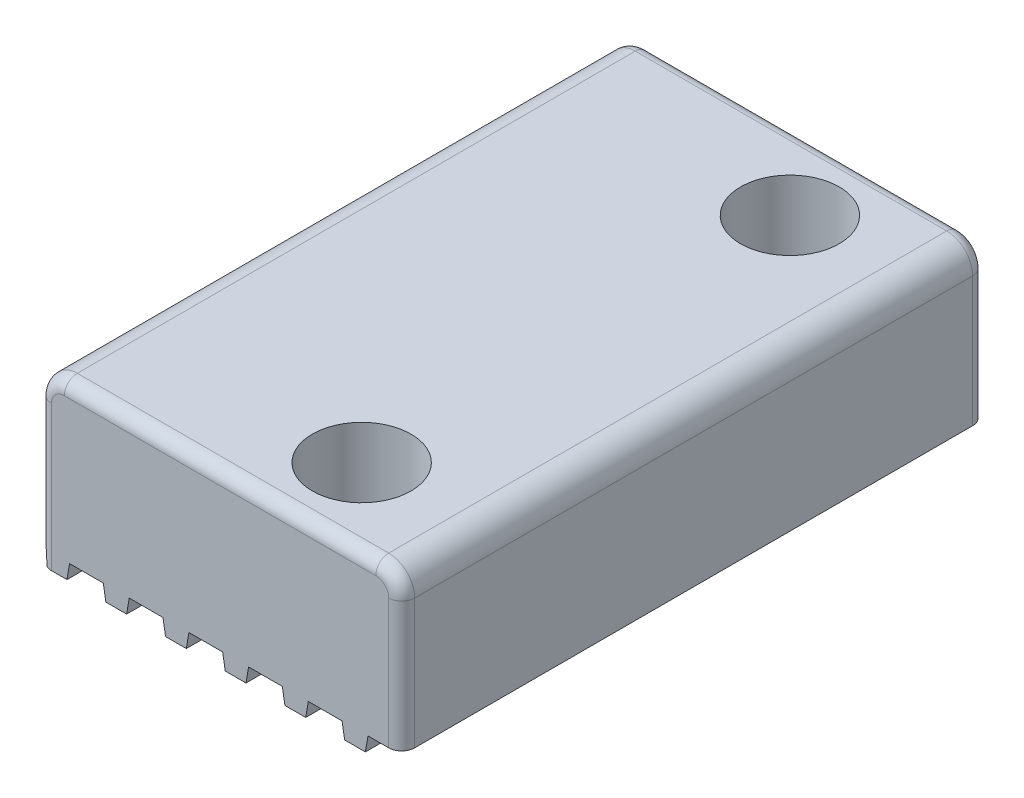
from build123d import *

# Parameters (mm, degrees)
BOSS_EXTRUDE1_DEPTH = 22.5
SKETCH2_R           = 1.9
CUT_EXTRUDE1_DEPTH  = 184.450850043
FILLET1_R           = 0.5


with BuildPart() as part:
    # Sketch1 → Boss-Extrude1 (new body)
    with BuildSketch(Plane.XY):
        with BuildLine():
            Line((167.946665474, 62.144706948), (167.946665474, 67.144706948))
            ThreePointArc((167.946665474, 67.144706948), (168.239558693, 67.851813729), (168.946665474, 68.144706948))
            Line((168.946665474, 68.144706948), (180.946665474, 68.144706948))
            ThreePointArc((180.946665474, 68.144706948), (181.653772255, 67.851813729), (181.946665474, 67.144706948))
            Line((181.946665474, 67.144706948), (181.946665474, 62.144706948))
            Line((181.946665474, 62.144706948), (180.646665474, 62.144706948))
            Line((180.646665474, 62.144706948), (180.546665474, 61.558713892))
            Line((180.546665474, 61.558713892), (179.746665474, 61.558713892))
            Line((179.746665474, 61.558713892), (179.646665474, 62.144706948))
            Line((179.646665474, 62.144706948), (178.346665474, 62.144706948))
            Line((178.346665474, 62.144706948), (178.246665474, 61.558713892))
            Line((178.246665474, 61.558713892), (177.446665474, 61.558713892))
            Line((177.446665474, 61.558713892), (177.346665474, 62.144706948))
            Line((177.346665474, 62.144706948), (176.046665474, 62.144706948))
            Line((176.046665474, 62.144706948), (175.946665474, 61.558713892))
            Line((175.946665474, 61.558713892), (175.146665474, 61.558713892))
            Line((175.146665474, 61.558713892), (175.046665474, 62.144706948))
            Line((175.046665474, 62.144706948), (173.746665474, 62.144706948))
            Line((173.746665474, 62.144706948), (173.646665474, 61.558713892))
            Line((173.646665474, 61.558713892), (172.846665474, 61.558713892))
            Line((172.846665474, 61.558713892), (172.746665474, 62.144706948))
            Line((172.746665474, 62.144706948), (171.446665474, 62.144706948))
            Line((171.446665474, 62.144706948), (171.346665474, 61.558713892))
            Line((171.346665474, 61.558713892), (170.546665474, 61.558713892))
            Line((170.546665474, 61.558713892), (170.446665474, 62.144706948))
            Line((170.446665474, 62.144706948), (169.146665474, 62.144706948))
            Line((169.146665474, 62.144706948), (169.046665474, 61.558713892))
            Line((169.046665474, 61.558713892), (168.246665474, 61.558713892))
            Line((168.246665474, 61.558713892), (168.146665474, 62.144706948))
            Line((168.146665474, 62.144706948), (167.946665474, 62.144706948))
        make_face()
    extrude(amount=-BOSS_EXTRUDE1_DEPTH)

    # Sketch2 → Cut-Extrude1 (cut, through all)
    with BuildSketch(Plane(origin=(0, 68.144706948, 0), x_dir=(1, 0, 0), z_dir=(0, 1, 0))):
        with Locations(Location((177.403833472, 3, 0), (0, 0, 270))):
            Circle(SKETCH2_R)
        with Locations(Location((177.403833472, 19.5, 0), (0, 0, 270))):
            Circle(SKETCH2_R)
    extrude(amount=-CUT_EXTRUDE1_DEPTH, mode=Mode.SUBTRACT)

    # Fillet1
    fillet1_edges = [part.edges().sort_by_distance(p)[0] for p in [
        (181.946665474, 64.644706948, -22.5),
        (181.653772255, 67.851813729, -22.5),
        (167.946665474, 64.644706948, -22.5),
        (168.239558693, 67.851813729, -22.5),
        (181.946665474, 64.644706948, 0),
        (181.653772255, 67.851813729, 0),
        (167.946665474, 64.644706948, 0),
        (168.239558693, 67.851813729, 0),
        (174.946665474, 68.144706948, -22.5),
        (174.946665474, 68.144706948, 0),
    ]]
    fillet(fillet1_edges, radius=FILLET1_R)


solid = part.part
